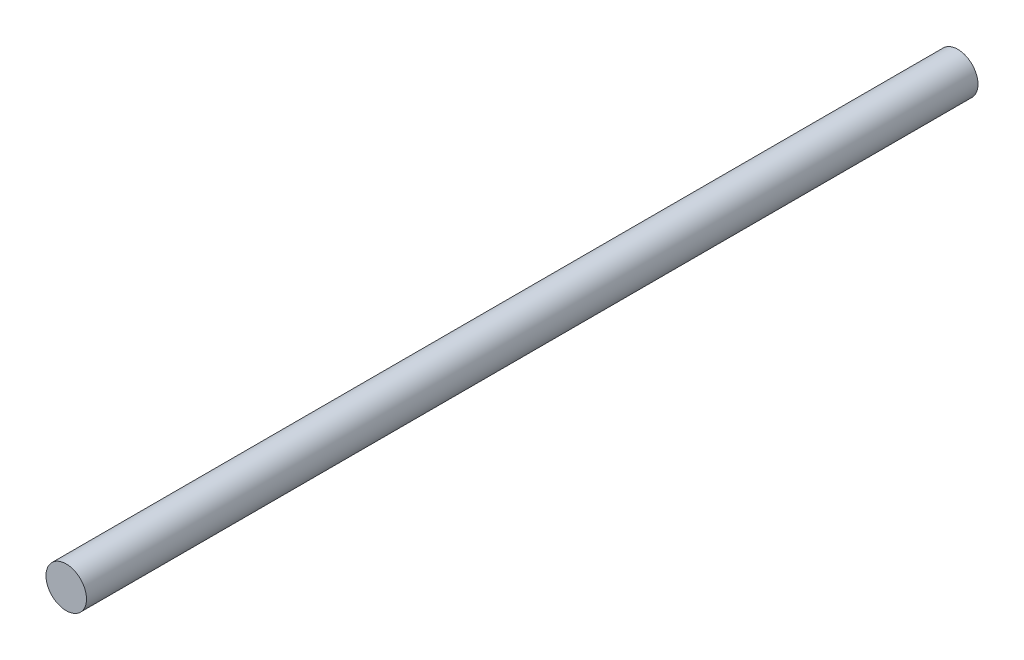
from build123d import *

# Parameters (mm, degrees)
DET2_KABLO_24V_MOTOR_D5_START = -690
SKETCH1_R                     = 2.5
DET2_KABLO_24V_MOTOR_D5_DEPTH = 110


with BuildPart() as part:
    # Sketch1 → DET2_kablo_24V_motor_D5 (new body)
    with BuildSketch(Plane.XY.offset(DET2_KABLO_24V_MOTOR_D5_START)):
        with Locations((744, 1550)):
            Circle(SKETCH1_R)
    extrude(amount=-DET2_KABLO_24V_MOTOR_D5_DEPTH)


solid = part.part
